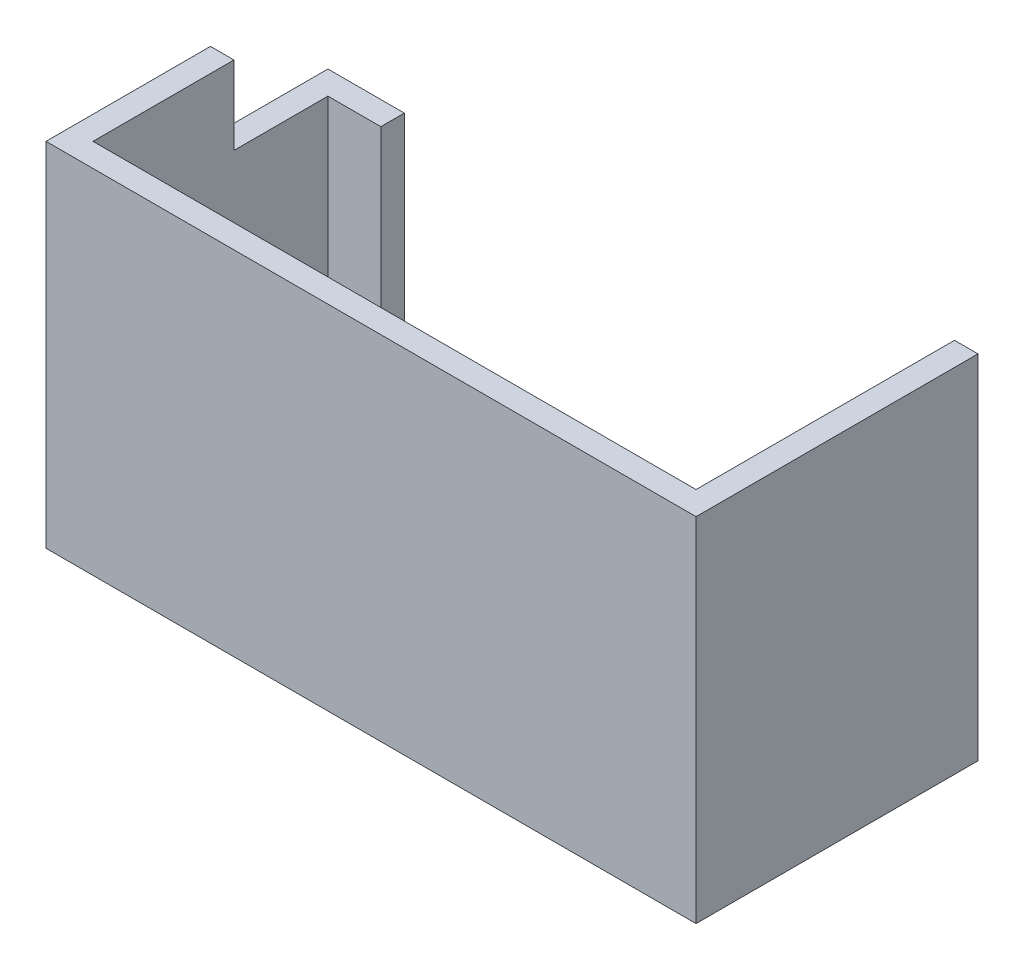
from build123d import *

# Parameters (mm, degrees)
SKETCH1_W           = 83
SKETCH1_H           = 36
SKETCH1_W_2         = 77
SKETCH1_H_2         = 30
BOSS_EXTRUDE1_DEPTH = 5
BOSS_EXTRUDE2_DEPTH = 40
SKETCH3_W           = 83
SKETCH3_H           = 36
BOSS_EXTRUDE3_DEPTH = 1
SKETCH4_W           = 9.752325518
SKETCH4_H           = 10
CUT_EXTRUDE1_DEPTH  = 15
CUT_EXTRUDE2_REACH  = 100.595
SKETCH5_W           = 7.400592898
SKETCH5_H           = 21.28859468


with BuildPart() as part:
    # Sketch1 → Boss-Extrude1 (new body)
    with BuildSketch(Plane(origin=(0, 0, 0), x_dir=(1, 0, 0), z_dir=(0, 1, 0))):
        with Locations((38.5, 15)):
            Rectangle(SKETCH1_W, SKETCH1_H)
        with Locations((38.5, 15)):
            Rectangle(SKETCH1_W_2, SKETCH1_H_2, mode=Mode.SUBTRACT)
    extrude(amount=BOSS_EXTRUDE1_DEPTH)

    # Sketch2 → Boss-Extrude2 (add)
    with BuildSketch(Plane(origin=(0, 5, 0), x_dir=(1, 0, 0), z_dir=(0, 1, 0))):
        Polygon((80, -3), (80, 33), (70.247674482, 33), (70.247674482, 30), (77, 30), (77, 0), (0, 0), (0, 30), (6.752325518, 30), (6.752325518, 33), (-3, 33), (-3, -3), align=None)
    extrude(amount=BOSS_EXTRUDE2_DEPTH)

    # Sketch3 → Boss-Extrude3 (add)
    with BuildSketch(Plane.XZ):
        with Locations((38.5, -15)):
            Rectangle(SKETCH3_W, SKETCH3_H)
    extrude(amount=-BOSS_EXTRUDE3_DEPTH)

    # Sketch4 → Cut-Extrude1 (cut)
    with BuildSketch(Plane(origin=(0, 0, -33), x_dir=(-1, 0, 0), z_dir=(0, 0, -1))):
        with Locations((-1.876162759, 40)):
            Rectangle(SKETCH4_W, SKETCH4_H)
    extrude(amount=-CUT_EXTRUDE1_DEPTH, mode=Mode.SUBTRACT)

    # Sketch5 → Cut-Extrude2 (cut, up to next)
    with BuildSketch(Plane(origin=(0, 0, -33), x_dir=(-1, 0, 0), z_dir=(0, 0, -1)), mode=Mode.PRIVATE) as cut_extrude2_sk1:
        with Locations((-73.299703551, 35.04429734)):
            Rectangle(SKETCH5_W, SKETCH5_H)
    cut_extrude2_tool1 = extrude(cut_extrude2_sk1.sketch, amount=-CUT_EXTRUDE2_REACH, mode=Mode.PRIVATE) & part.part
    add(cut_extrude2_tool1.solids().sort_by_distance((73.299704, 35.044297, -33))[0], mode=Mode.SUBTRACT)


solid = part.part
